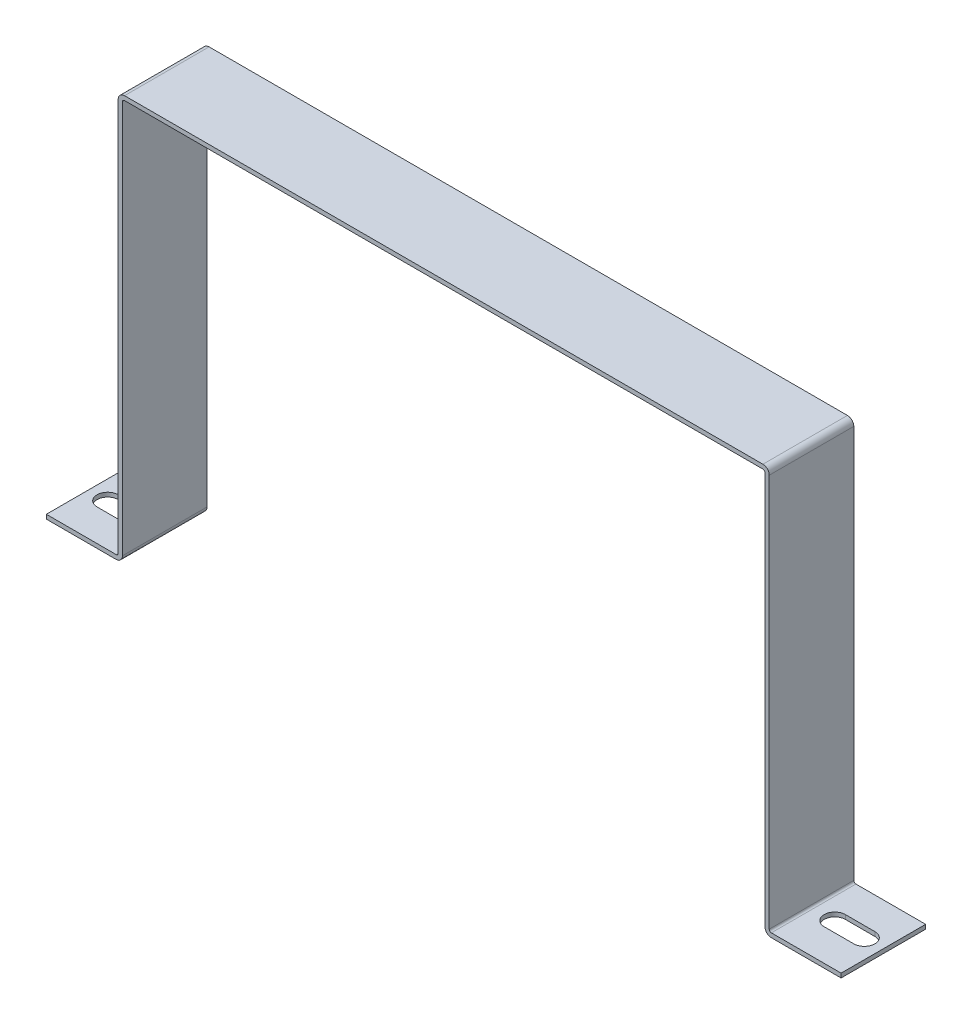
from build123d import *

# Parameters (mm, degrees)
EXTRUSION1_DEPTH        = 20
ENL_V_MAT_EXTRU_1_DEPTH = 136.838138974


with BuildPart() as part:
    # Esquisse1 → Extrusion1 (new body)
    with BuildSketch(Plane.XY):
        with BuildLine():
            Line((75.5, 95), (-75.5, 95))
            ThreePointArc((-75.5, 95), (-75.853553391, 94.853553391), (-76, 94.5))
            Line((-76, 94.5), (-76, 1.5))
            ThreePointArc((-76, 1.5), (-76.439339828, 0.439339828), (-77.5, 0))
            Line((-77.5, 0), (-94, 0))
            Line((-94, 0), (-94, 1))
            Line((-94, 1), (-77.5, 1))
            ThreePointArc((-77.5, 1), (-77.146446609, 1.146446609), (-77, 1.5))
            Line((-77, 1.5), (-77, 94.5))
            ThreePointArc((-77, 94.5), (-76.560660172, 95.560660172), (-75.5, 96))
            Line((-75.5, 96), (75.5, 96))
            ThreePointArc((75.5, 96), (76.560660172, 95.560660172), (77, 94.5))
            Line((77, 94.5), (77, 1.5))
            ThreePointArc((77, 1.5), (77.146446609, 1.146446609), (77.5, 1))
            Line((77.5, 1), (94, 1))
            Line((94, 1), (94, 0))
            Line((94, 0), (77.5, 0))
            ThreePointArc((77.5, 0), (76.439339828, 0.439339828), (76, 1.5))
            Line((76, 1.5), (76, 94.5))
            ThreePointArc((76, 94.5), (75.853553391, 94.853553391), (75.5, 95))
        make_face()
    extrude(amount=EXTRUSION1_DEPTH)

    # Esquisse2 → Enlèv. mat.-Extru.1 (cut, through all)
    with BuildSketch(Plane.XZ):
        with BuildLine():
            Line((-89.5, 12.5), (-82.5, 12.5))
            ThreePointArc((-82.5, 12.5), (-80, 10), (-82.5, 7.5))
            Line((-82.5, 7.5), (-89.5, 7.5))
            ThreePointArc((-89.5, 7.5), (-92, 10), (-89.5, 12.5))
        make_face()
        with BuildLine():
            Line((89.5, 7.5), (82.5, 7.5))
            ThreePointArc((82.5, 7.5), (80, 10), (82.5, 12.5))
            Line((82.5, 12.5), (89.5, 12.5))
            ThreePointArc((89.5, 12.5), (92, 10), (89.5, 7.5))
        make_face()
    extrude(amount=-ENL_V_MAT_EXTRU_1_DEPTH, mode=Mode.SUBTRACT)


solid = part.part
